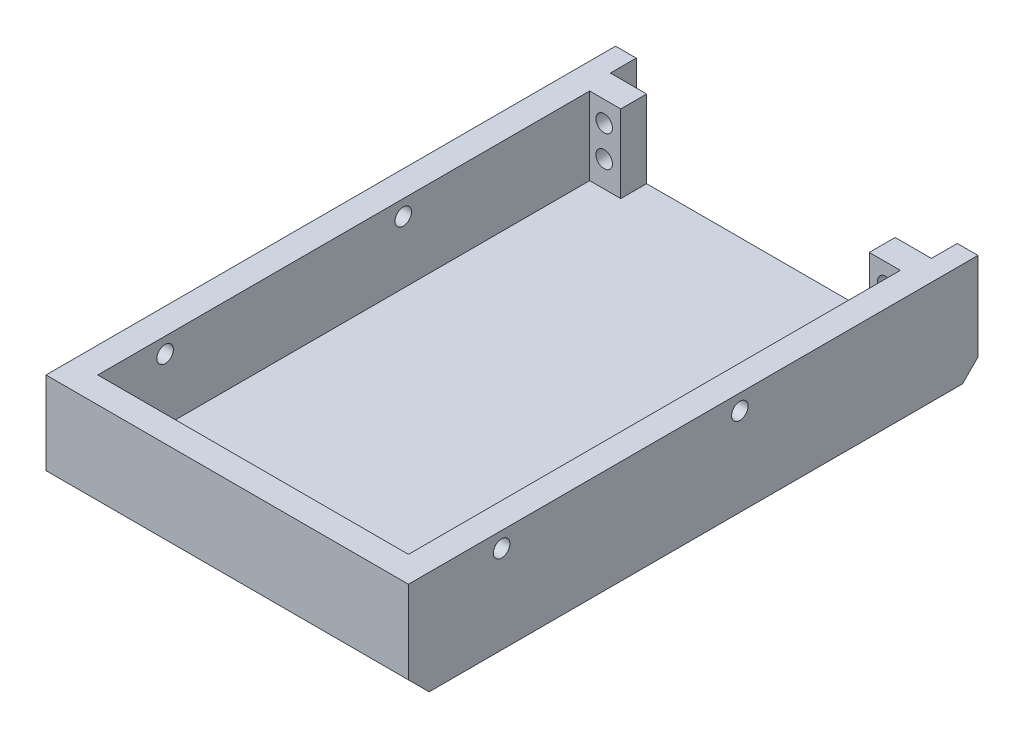
from build123d import *

# Parameters (mm, degrees)
CROQUIS1_W                 = 70
CROQUIS1_H                 = 105
SALIENTE_EXTRUIR1_DEPTH    = 20
VACIADO1_T                 = -5
CROQUIS3_R                 = 1.6
CORTAR_EXTRUIR1_DEPTH      = 70
CROQUIS4_W                 = 60
CROQUIS4_H                 = 15
CORTAR_EXTRUIR2_DEPTH      = 5
CROQUIS5_W                 = 5
CROQUIS5_H                 = 15
SALIENTE_EXTRUIR2_DEPTH    = 6
CORTAR_EXTRUIR3_REACH      = 114.472
CROQUIS6_R                 = 1.6
CROQUIS7_W                 = 4
CROQUIS7_H                 = 5
SALIENTE_EXTRUIR3_DEPTH    = 20
CHAFL_N1_SIZE              = 3
CHAFL_N1_OF_SIMETR_A3_SIZE = 3
CHAFL_N2_SIZE              = 4


with BuildPart() as part:
    # Croquis1 → Saliente-Extruir1 (new body)
    with BuildSketch(Plane(origin=(0, 0, 0), x_dir=(1, 0, 0), z_dir=(0, 1, 0))):
        Rectangle(CROQUIS1_W, CROQUIS1_H)
    extrude(amount=SALIENTE_EXTRUIR1_DEPTH)

    # Vaciado1
    vaciado1_openings = [part.faces().sort_by_distance(p)[0] for p in [
        (0, 20, 0),
    ]]
    offset(amount=VACIADO1_T, openings=vaciado1_openings, kind=Kind.INTERSECTION)

    # Croquis3 → Cortar-Extruir1 (cut)
    with BuildSketch(Plane.ZY.offset(35)):
        with Locations((34.5, 17)):
            Circle(CROQUIS3_R)
        with Locations((-11.5, 17)):
            Circle(CROQUIS3_R)
    extrude(amount=-CORTAR_EXTRUIR1_DEPTH, mode=Mode.SUBTRACT)

    # Croquis4 → Cortar-Extruir2 (cut)
    with BuildSketch(Plane(origin=(0, 0, -52.5), x_dir=(-1, 0, 0), z_dir=(0, 0, -1))):
        with Locations((0, 12.5)):
            Rectangle(CROQUIS4_W, CROQUIS4_H)
    extrude(amount=-CORTAR_EXTRUIR2_DEPTH, mode=Mode.SUBTRACT)

    # Croquis5 → Saliente-Extruir2 (add)
    with BuildSketch(Plane(origin=(-30, 0, 0), x_dir=(0, 0, -1), z_dir=(1, 0, 0))):
        with Locations((50, 12.5)):
            Rectangle(CROQUIS5_W, CROQUIS5_H)
    saliente_extruir2 = extrude(amount=SALIENTE_EXTRUIR2_DEPTH)

    # Simetría1: Saliente-Extruir2 across plane
    add(saliente_extruir2.mirror(Plane(origin=(0, 0, 0), x_dir=(0, 0, 1), z_dir=(1, 0, 0))))

    # Croquis6 → Cortar-Extruir3 (cut, up to next)
    with BuildSketch(Plane(origin=(0, 0, -52.5), x_dir=(-1, 0, 0), z_dir=(0, 0, -1)), mode=Mode.PRIVATE) as cortar_extruir3_sk1:
        with Locations((-27.2, 16)):
            Circle(CROQUIS6_R)
    cortar_extruir3_tool1 = extrude(cortar_extruir3_sk1.sketch, amount=-CORTAR_EXTRUIR3_REACH, mode=Mode.PRIVATE) & part.part
    # Croquis6 → Cortar-Extruir3 (cut, up to next)
    with BuildSketch(Plane(origin=(0, 0, -52.5), x_dir=(-1, 0, 0), z_dir=(0, 0, -1)), mode=Mode.PRIVATE) as cortar_extruir3_sk2:
        with Locations((-27.2, 10)):
            Circle(CROQUIS6_R)
    cortar_extruir3_tool2 = extrude(cortar_extruir3_sk2.sketch, amount=-CORTAR_EXTRUIR3_REACH, mode=Mode.PRIVATE) & part.part
    cortar_extruir3_1 = cortar_extruir3_tool1.solids().sort_by_distance((27.2, 16, -52.5))[0]
    add(cortar_extruir3_1, mode=Mode.SUBTRACT)
    cortar_extruir3_2 = cortar_extruir3_tool2.solids().sort_by_distance((27.2, 10, -52.5))[0]
    add(cortar_extruir3_2, mode=Mode.SUBTRACT)
    cortar_extruir3 = cortar_extruir3_1 + cortar_extruir3_2  # Cortar-Extruir3 as one shape, for the pattern or mirror that repeats it

    # Simetría2: Cortar-Extruir3 across plane
    add(cortar_extruir3.mirror(Plane(origin=(0, 0, 0), x_dir=(0, 0, 1), z_dir=(1, 0, 0))), mode=Mode.SUBTRACT)

    # Croquis7 → Saliente-Extruir3 (add)
    with BuildSketch(Plane(origin=(0, 0, 0), x_dir=(1, 0, 0), z_dir=(0, 1, 0))):
        with Locations((33, 55)):
            Rectangle(CROQUIS7_W, CROQUIS7_H)
    saliente_extruir3 = extrude(amount=SALIENTE_EXTRUIR3_DEPTH)

    # Chaflán1
    chafl_n1_edges = [part.edges().sort_by_distance(p)[0] for p in [
        (33, 0, -57.5),
    ]]
    chamfer(chafl_n1_edges, length=CHAFL_N1_SIZE)

    # Simetría3: Saliente-Extruir3 across plane
    add(saliente_extruir3.mirror(Plane(origin=(0, 0, 0), x_dir=(0, 0, 1), z_dir=(1, 0, 0))))

    # Chaflán1 of Simetría3
    chafl_n1_of_simetr_a3_edges = [part.edges().sort_by_distance(p)[0] for p in [
        (-33, 0, -57.5),
    ]]
    chamfer(chafl_n1_of_simetr_a3_edges, length=CHAFL_N1_OF_SIMETR_A3_SIZE)

    # Chaflán2
    chafl_n2_edges = [part.edges().sort_by_distance(p)[0] for p in [
        (0, 0, 52.5),
    ]]
    chamfer(chafl_n2_edges, length=CHAFL_N2_SIZE)


solid = part.part
